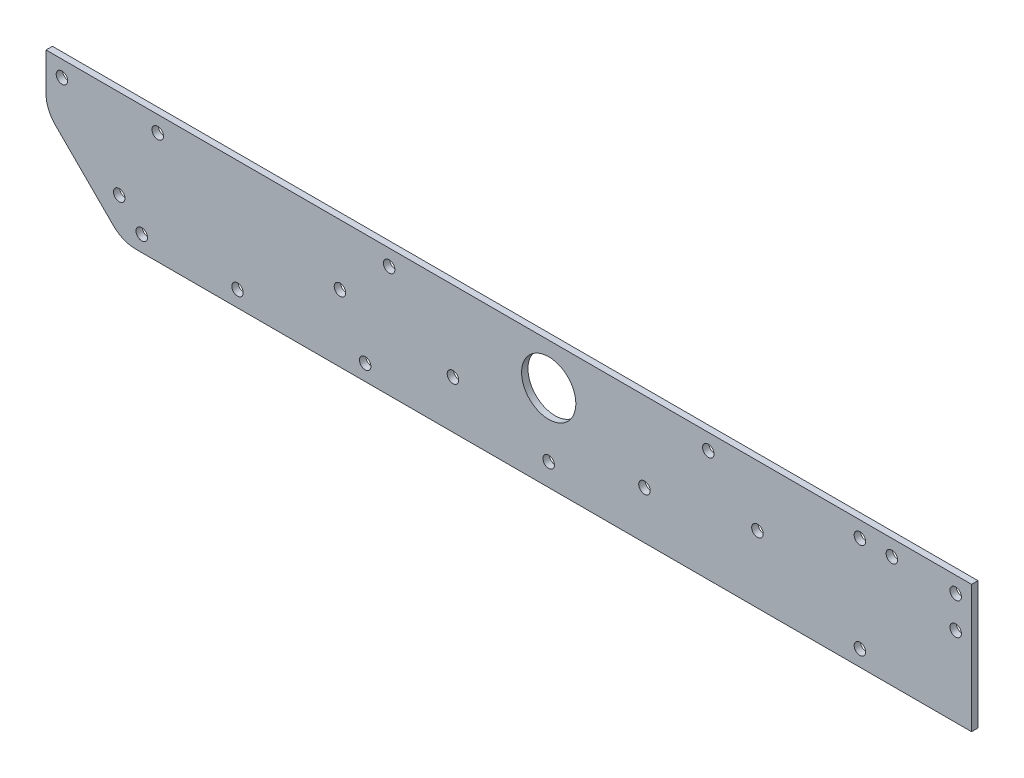
from build123d import *

# Parameters (mm, degrees)
SKETCH1_W           = 368.3
SKETCH1_H           = 50.8
SKETCH1_R           = 2.286
SKETCH1_R_2         = 10.795
BOSS_EXTRUDE1_DEPTH = 2.54
CUT_EXTRUDE1_DEPTH  = 2.54
FILLET1_R           = 12.7
SKETCH4_R           = 2.286
CUT_EXTRUDE3_DEPTH  = 372.795618048
SKETCH5_R           = 2.286
CUT_EXTRUDE4_DEPTH  = 372.795618048


with BuildPart() as part:
    # Sketch1 → Boss-Extrude1 (new body)
    with BuildSketch(Plane.XY):
        with Locations((-184.15, 25.4)):
            Rectangle(SKETCH1_W, SKETCH1_H)
        with Locations((-44.45, 6.35)):
            Circle(SKETCH1_R, mode=Mode.SUBTRACT)
        with Locations((-292.1, 6.35)):
            Circle(SKETCH1_R, mode=Mode.SUBTRACT)
        with Locations((-130.175, 19.05)):
            Circle(SKETCH1_R, mode=Mode.SUBTRACT)
        with Locations((-206.375, 19.05)):
            Circle(SKETCH1_R, mode=Mode.SUBTRACT)
        with Locations((-168.275, 34.29)):
            Circle(SKETCH1_R_2, mode=Mode.SUBTRACT)
        with Locations((-251.333, 26.67)):
            Circle(SKETCH1_R, mode=Mode.SUBTRACT)
        with Locations(Location((-85.217, 26.67, 0), (0, 0, 180))):
            Circle(SKETCH1_R, mode=Mode.SUBTRACT)
        with Locations((-330.2, 6.35)):
            Circle(SKETCH1_R, mode=Mode.SUBTRACT)
        with Locations((-241.3, 6.35)):
            Circle(SKETCH1_R, mode=Mode.SUBTRACT)
        with Locations((-361.95, 44.45)):
            Circle(SKETCH1_R, mode=Mode.SUBTRACT)
        with Locations((-323.85, 44.45)):
            Circle(SKETCH1_R, mode=Mode.SUBTRACT)
        with Locations((-339.180256121, 15.330256121)):
            Circle(SKETCH1_R, mode=Mode.SUBTRACT)
    extrude(amount=BOSS_EXTRUDE1_DEPTH)

    # Sketch2 → Cut-Extrude1 (cut)
    with BuildSketch(Plane.XY.offset(2.54)):
        Polygon((-388.62, 50.8), (-337.82, 0), (-388.62, 0), align=None)
    extrude(amount=-CUT_EXTRUDE1_DEPTH, mode=Mode.SUBTRACT)

    # Fillet1
    fillet1_edges = [part.edges().sort_by_distance(p)[0] for p in [
        (-337.82, 0, 1.27),
        (-368.3, 30.48, 1.27),
    ]]
    fillet(fillet1_edges, radius=FILLET1_R)

    # Sketch4 → Cut-Extrude3 (cut, through all)
    with BuildSketch(Plane.XY.offset(2.54)):
        with Locations((-231.775, 44.45)):
            Circle(SKETCH4_R)
        with Locations((-104.775, 44.45)):
            Circle(SKETCH4_R)
        with Locations((-168.275, 8.89)):
            Circle(SKETCH4_R)
    extrude(amount=-CUT_EXTRUDE3_DEPTH, mode=Mode.SUBTRACT)

    # Sketch5 → Cut-Extrude4 (cut, through all)
    with BuildSketch(Plane.XY.offset(2.54)):
        with Locations((-44.45, 44.45)):
            Circle(SKETCH5_R)
        with Locations((-31.75, 44.45)):
            Circle(SKETCH5_R)
        with Locations((-6.35, 44.45)):
            Circle(SKETCH5_R)
        with Locations((-6.35, 31.75)):
            Circle(SKETCH5_R)
    extrude(amount=-CUT_EXTRUDE4_DEPTH, mode=Mode.SUBTRACT)


solid = part.part
